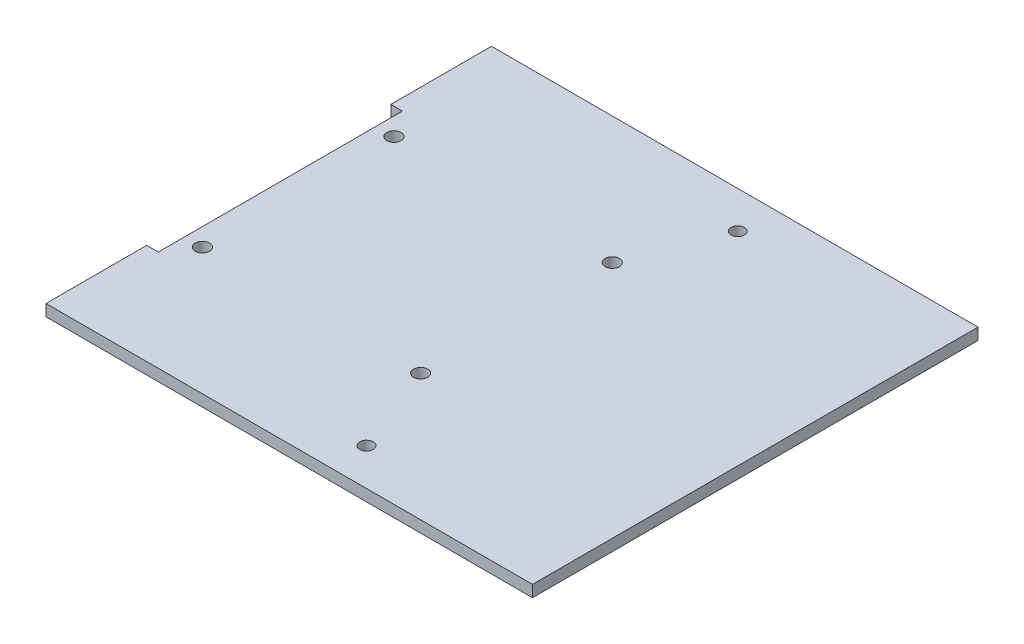
from build123d import *

# Parameters (mm, degrees)
EXTRUDE_1_DEPTH                  = 2.6
SKETCH_2_W                       = 100
SKETCH_2_H                       = 24
EXTRUDE_2_DEPTH                  = 2.6
SKETCH_4_W                       = 100
SKETCH_4_H                       = 24
EXTRUDE_3_DEPTH                  = 2.6
SKETCH_5_W                       = 62
SKETCH_5_H                       = 100
EXTRUDE_5_DEPTH                  = 2.6
SKETCH_7_W                       = 62
SKETCH_7_H                       = 100
EXTRUDE_6_DEPTH                  = 2.6
SKETCH_8_W                       = 59.4
SKETCH_8_H                       = 60
CUT_EXTRUDE_1_DEPTH              = 2.6
SKETCH_9_W                       = 59.4
SKETCH_9_H                       = 60
CUT_EXTRUDE_2_DEPTH              = 2.6
SKETCH_11_W                      = 59.4
SKETCH_11_H                      = 26.6
EXTRUDE_7_DEPTH                  = 2.6
SKETCH_12_W                      = 59.4
SKETCH_12_H                      = 26.6
EXTRUDE_8_DEPTH                  = 2.6
SKETCH_14_W                      = 59.4
SKETCH_14_H                      = 26.6
EXTRUDE_9_DEPTH                  = 2.6
SKETCH_15_W                      = 59.4
SKETCH_15_H                      = 26.6
EXTRUDE_10_DEPTH                 = 2.6
SKETCH_16_R                      = 1.6
CUT_EXTRUDE_3_DEPTH              = 127.775391934
SKETCH_17_W                      = 80
SKETCH_17_H                      = 64
CUT_EXTRUDE_4_DEPTH              = 127.775391934
SKETCH_21_W                      = 59.4
SKETCH_21_H                      = 54.8
EXTRUDE_11_DEPTH                 = 2.6
SKETCH_22_R                      = 1.6
CUT_EXTRUDE_5_DEPTH              = 2.6
SKETCH_23_W                      = 59.4
SKETCH_23_H                      = 54.8
EXTRUDE_13_DEPTH                 = 2.6
CUT_EXTRUDE_8_DEPTH              = 2.6
SKETCH_25_W                      = 54.8
SKETCH_25_H                      = 21.4
CUT_EXTRUDE_9_DEPTH              = 2.6
CUT_EXTRUDE_11_REACH             = 143.787
SKETCH_28_R                      = 1.5
CUT_EXTRUDE_11_DIRECTION_2_DEPTH = 142.787023384
SKETCH_31_W                      = 41.995824489
SKETCH_31_H                      = 54.8
CUT_EXTRUDE_14_DEPTH             = 2.6
SKETCH_32_W                      = 59.4
SKETCH_32_H                      = 24
CUT_EXTRUDE_15_DEPTH             = 70.6
SKETCH_33_W                      = 104
SKETCH_33_H                      = 100
CUT_EXTRUDE_16_DEPTH             = 2.6
SKETCH_34_W                      = 104
SKETCH_34_H                      = 99.672593916
EXTRUDE_14_DEPTH                 = 2.6
SKETCH_35_R                      = 1.6
CUT_EXTRUDE_24_DEPTH             = 2.6
SKETCH_36_W                      = 59.4
SKETCH_36_H                      = 100
CUT_EXTRUDE_25_DEPTH             = 2.6
SKETCH_37_W                      = 36
SKETCH_37_H                      = 2.6
EXTRUDE_17_DEPTH                 = 36
SKETCH_41_W                      = 36
SKETCH_41_H                      = 12
CUT_EXTRUDE_27_DEPTH             = 2.6
SKETCH_42_R                      = 1.6
CUT_EXTRUDE_28_DEPTH             = 2.6
SKETCH_43_R                      = 2
CUT_EXTRUDE_29_DEPTH             = 2.6
SKETCH_44_W                      = 104
SKETCH_44_H                      = 99.672593916
EXTRUDE_18_DEPTH                 = 2.6
SKETCH_45_R                      = 1.6
CUT_EXTRUDE_30_DEPTH             = 2.6
SKETCH_46_W                      = 80
SKETCH_46_H                      = 64
CUT_EXTRUDE_31_DEPTH             = 2.6
SKETCH_47_W                      = 40
SKETCH_47_H                      = 30
CUT_EXTRUDE_32_DEPTH             = 2.6
SKETCH_48_W                      = 12
SKETCH_48_H                      = 64
CUT_EXTRUDE_33_DEPTH             = 2.6
SKETCH_49_W                      = 40
SKETCH_49_H                      = 20
CUT_EXTRUDE_34_DEPTH             = 2.6
SKETCH_50_W                      = 39.937786469
SKETCH_50_H                      = 20
CUT_EXTRUDE_35_DEPTH             = 2.6
SKETCH_51_R                      = 9
CUT_EXTRUDE_36_DEPTH             = 2.6
CUT_EXTRUDE_38_REACH             = 143.787
SKETCH_52_W                      = 15
SKETCH_52_H                      = 15
SKETCH_55_W                      = 36
SKETCH_55_H                      = 2.6
CUT_EXTRUDE_39_DEPTH             = 12
CUT_EXTRUDE_START                = -109.2
SKETCH_56_W                      = 10
SKETCH_56_H                      = 10
CUT_EXTRUDE_40_DEPTH             = 109.2
CUT_EXTRUDE_41_REACH             = 129.293
SKETCH_57_R                      = 1.5
SKETCH_58_W                      = 104
SKETCH_58_H                      = 2.6
EXTRUDE_19_DEPTH                 = 0.327406084
SKETCH_59_W                      = 59.4
SKETCH_59_H                      = 24
CUT_EXTRUDE_42_DEPTH             = 60
SKETCH_60_W                      = 168.6
SKETCH_60_H                      = 100
CUT_EXTRUDE_43_DEPTH             = 2.6
CUT_EXTRUDE_44_DEPTH             = 200
CUT_EXTRUDE_44_DEPTH_BACK        = 200
SKETCH_61_W                      = 100
SKETCH_61_H                      = 21.4
SKETCH_62_W                      = 20
SKETCH_62_H                      = 2.6
EXTRUDE_20_DEPTH                 = 39.937786469
SKETCH_63_W                      = 40
SKETCH_63_H                      = 2.6
EXTRUDE_21_DEPTH                 = 50
SKETCH_64_R                      = 1.6
CUT_EXTRUDE_45_DEPTH             = 2.6
SKETCH_65_R                      = 1.6
EXTRUDE_23_DEPTH                 = 2.6


with BuildPart() as part:
    # 草图1 → 凸台-拉伸1 (new body)
    with BuildSketch(Plane(origin=(0, 0, 0), x_dir=(1, 0, 0), z_dir=(0, 1, 0))):
        Polygon((52, 50), (0, 50), (-52, 50), (-52, -50), (52, -50), align=None)
    extrude(amount=EXTRUDE_1_DEPTH)

    # 草图2 → 凸台-拉伸2 (add)
    with BuildSketch(Plane.ZY.offset(52)):
        with Locations((0, 12)):
            Rectangle(SKETCH_2_W, SKETCH_2_H)
    extrude(amount=EXTRUDE_2_DEPTH)

    # 草图4 → 凸台-拉伸3 (add)
    with BuildSketch(Plane(origin=(52, 0, 0), x_dir=(0, 0, -1), z_dir=(1, 0, 0))):
        with Locations((0, 12)):
            Rectangle(SKETCH_4_W, SKETCH_4_H)
    extrude(amount=EXTRUDE_3_DEPTH)

    # 草图5 → 凸台-拉伸5 (add)
    with BuildSketch(Plane(origin=(0, 24, 0), x_dir=(1, 0, 0), z_dir=(0, 1, 0))):
        with Locations((-83, 0)):
            Rectangle(SKETCH_5_W, SKETCH_5_H)
    extrude(amount=EXTRUDE_5_DEPTH)

    # 草图7 → 凸台-拉伸6 (add)
    with BuildSketch(Plane(origin=(0, 24, 0), x_dir=(1, 0, 0), z_dir=(0, 1, 0))):
        with Locations((83, 0)):
            Rectangle(SKETCH_7_W, SKETCH_7_H)
    extrude(amount=EXTRUDE_6_DEPTH)

    # 草图8 → 切除-拉伸1 (cut)
    with BuildSketch(Plane(origin=(0, 24, 0), x_dir=(1, 0, 0), z_dir=(0, 1, 0))):
        with Locations((-84.3, 0)):
            Rectangle(SKETCH_8_W, SKETCH_8_H)
    extrude(amount=CUT_EXTRUDE_1_DEPTH, mode=Mode.SUBTRACT)

    # 草图9 → 切除-拉伸2 (cut)
    with BuildSketch(Plane.XZ.offset(-24)):
        with Locations((84.3, 0)):
            Rectangle(SKETCH_9_W, SKETCH_9_H)
    extrude(amount=-CUT_EXTRUDE_2_DEPTH, mode=Mode.SUBTRACT)

    # 草图11 → 凸台-拉伸7 (add)
    with BuildSketch(Plane(origin=(0, 0, 30), x_dir=(-1, 0, 0), z_dir=(0, 0, -1))):
        with Locations((-84.3, 13.3)):
            Rectangle(SKETCH_11_W, SKETCH_11_H)
    extrude(amount=EXTRUDE_7_DEPTH)

    # 草图12 → 凸台-拉伸8 (add)
    with BuildSketch(Plane.XY.offset(-30)):
        with Locations((84.3, 13.3)):
            Rectangle(SKETCH_12_W, SKETCH_12_H)
    extrude(amount=EXTRUDE_8_DEPTH)

    # 草图14 → 凸台-拉伸9 (add)
    with BuildSketch(Plane.XY.offset(-30)):
        with Locations((-84.3, 13.3)):
            Rectangle(SKETCH_14_W, SKETCH_14_H)
    extrude(amount=EXTRUDE_9_DEPTH)

    # 草图15 → 凸台-拉伸10 (add)
    with BuildSketch(Plane(origin=(0, 0, 30), x_dir=(-1, 0, 0), z_dir=(0, 0, -1))):
        with Locations((84.3, 13.3)):
            Rectangle(SKETCH_15_W, SKETCH_15_H)
    extrude(amount=EXTRUDE_10_DEPTH)

    # 草图16 → 切除-拉伸3 (cut, through all)
    with BuildSketch(Plane(origin=(0, 2.6, 0), x_dir=(1, 0, 0), z_dir=(0, 1, 0))):
        with Locations(Location((-47.5, 37.465, 0), (0, 0, 270))):
            Circle(SKETCH_16_R)
        with Locations(Location((47.5, 37.465, 0), (0, 0, 90))):
            Circle(SKETCH_16_R)
        with Locations(Location((-47.5, -37.465, 0), (0, 0, 90))):
            Circle(SKETCH_16_R)
        with Locations(Location((47.5, -37.465, 0), (0, 0, 270))):
            Circle(SKETCH_16_R)
    extrude(amount=-CUT_EXTRUDE_3_DEPTH, mode=Mode.SUBTRACT)

    # 草图17 → 切除-拉伸4 (cut, through all)
    with BuildSketch(Plane(origin=(0, 2.6, 0), x_dir=(1, 0, 0), z_dir=(0, 1, 0))):
        Rectangle(SKETCH_17_W, SKETCH_17_H)
    extrude(amount=-CUT_EXTRUDE_4_DEPTH, mode=Mode.SUBTRACT)

    # 草图21 → 凸台-拉伸11 (add)
    with BuildSketch(Plane.XZ):
        with Locations((-84.3, 0)):
            Rectangle(SKETCH_21_W, SKETCH_21_H)
    extrude(amount=-EXTRUDE_11_DEPTH)

    # 草图22 → 切除-拉伸5 (cut)
    with BuildSketch(Plane(origin=(0, 2.6, 0), x_dir=(1, 0, 0), z_dir=(0, 1, 0))):
        with Locations(Location((-109, 18, 0), (0, 0, 270))):
            Circle(SKETCH_22_R)
        with Locations(Location((-109, 0, 0), (0, 0, 270))):
            Circle(SKETCH_22_R)
        with Locations(Location((-109, -18, 0), (0, 0, 90))):
            Circle(SKETCH_22_R)
    extrude(amount=-CUT_EXTRUDE_5_DEPTH, mode=Mode.SUBTRACT)

    # 草图23 → 凸台-拉伸13 (add)
    with BuildSketch(Plane(origin=(0, 26.6, 0), x_dir=(1, 0, 0), z_dir=(0, 1, 0))):
        with Locations((-84.3, 0)):
            Rectangle(SKETCH_23_W, SKETCH_23_H)
    extrude(amount=-EXTRUDE_13_DEPTH)

    # 草图24 → 切除-拉伸8 (cut)
    with BuildSketch(Plane(origin=(0, 26.6, 0), x_dir=(1, 0, 0), z_dir=(0, 1, 0))):
        Polygon((-114, 27.4), (-104, 27.4), (-104, 0.9702404), (-94.7, 0.9702404), (-94.7, 6.15), (-72, 6.15), (-72, 0.9702404), (-62.7, 0.9702404), (-62.7, -1.0297596), (-72, -1.0297596), (-72, -6.15), (-94.7, -6.15), (-94.7, -1.0297596), (-104, -1.0297596), (-104, -27.4), (-114, -27.4), align=None)
    extrude(amount=-CUT_EXTRUDE_8_DEPTH, mode=Mode.SUBTRACT)

    # 草图25 → 切除-拉伸9 (cut)
    with BuildSketch(Plane.ZY.offset(54.6)):
        with Locations((0, 13.3)):
            Rectangle(SKETCH_25_W, SKETCH_25_H)
    extrude(amount=-CUT_EXTRUDE_9_DEPTH, mode=Mode.SUBTRACT)

    # 切除-拉伸11: up to this face of the body (flat: up to its plane)
    cut_extrude_11_end = Plane(part.part.faces().sort_by_distance((-84.3, 12, -30))[0])
    # 草图28 → 切除-拉伸11 (cut, up to the picked face)
    with BuildSketch(Plane.XY.offset(30), mode=Mode.PRIVATE) as cut_extrude_11_sk1:
        with Locations(Location((-87.2, 20.75, 0), (0, 0, 180))):
            Circle(SKETCH_28_R)
    cut_extrude_11_tool1 = split(extrude(cut_extrude_11_sk1.sketch, amount=-CUT_EXTRUDE_11_REACH, mode=Mode.PRIVATE), bisect_by=cut_extrude_11_end, keep=Keep.BOTH, mode=Mode.PRIVATE)
    # 草图28 → 切除-拉伸11 (cut, up to the picked face)
    with BuildSketch(Plane.XY.offset(30), mode=Mode.PRIVATE) as cut_extrude_11_sk2:
        with Locations(Location((-87.2, 3.25, 0), (0, 0, 180))):
            Circle(SKETCH_28_R)
    cut_extrude_11_tool2 = split(extrude(cut_extrude_11_sk2.sketch, amount=-CUT_EXTRUDE_11_REACH, mode=Mode.PRIVATE), bisect_by=cut_extrude_11_end, keep=Keep.BOTH, mode=Mode.PRIVATE)
    add(cut_extrude_11_tool1.solids().sort_by(Axis((-87.2, 20.75, 30), (0, 0, -1)))[0], mode=Mode.SUBTRACT)
    add(cut_extrude_11_tool2.solids().sort_by(Axis((-87.2, 3.25, 30), (0, 0, -1)))[0], mode=Mode.SUBTRACT)

    # 草图28 → 切除-拉伸11 direction 2 (cut)
    with BuildSketch(Plane.XY.offset(30)):
        with Locations(Location((-87.2, 20.75, 0), (0, 0, 180))):
            Circle(SKETCH_28_R)
        with Locations(Location((-87.2, 3.25, 0), (0, 0, 180))):
            Circle(SKETCH_28_R)
    extrude(amount=CUT_EXTRUDE_11_DIRECTION_2_DEPTH, mode=Mode.SUBTRACT)

    # 草图31 → 切除-拉伸14 (cut)
    with BuildSketch(Plane(origin=(0, 2.6, 0), x_dir=(1, 0, 0), z_dir=(0, 1, 0))):
        with Locations((-72.997912245, 0)):
            Rectangle(SKETCH_31_W, SKETCH_31_H)
    extrude(amount=-CUT_EXTRUDE_14_DEPTH, mode=Mode.SUBTRACT)

    # 草图32 → 切除-拉伸15 (cut)
    with BuildSketch(Plane.XY.offset(30)):
        with Locations((84.3, 12)):
            Rectangle(SKETCH_32_W, SKETCH_32_H)
    extrude(amount=-CUT_EXTRUDE_15_DEPTH, mode=Mode.SUBTRACT)

    # 草图33 → 切除-拉伸16 (cut)
    with BuildSketch(Plane(origin=(0, 2.6, 0), x_dir=(1, 0, 0), z_dir=(0, 1, 0))):
        Rectangle(SKETCH_33_W, SKETCH_33_H)
    extrude(amount=-CUT_EXTRUDE_16_DEPTH, mode=Mode.SUBTRACT)


with BuildPart() as cut_extrude_16_piece_1:
    # of the separate pieces the step leaves, piece 1, a body of its own (cut_extrude_16_pieces)
    add(part.part.solids().sort_by_distance((-52, 0, -50))[0])



with BuildPart() as cut_extrude_16_piece_2:
    # of the separate pieces the step leaves, piece 2, a body of its own (cut_extrude_16_pieces)
    add(part.part.solids().sort_by_distance((114, 26.6, -50))[0])


with BuildPart() as cut_extrude_16_piece_1_1:
    add(cut_extrude_16_piece_1.part)

    add(cut_extrude_16_piece_2.part)  # 凸台-拉伸14 merges 切除-拉伸16 piece 2
    # 草图34 → 凸台-拉伸14 (add)
    with BuildSketch(Plane.XZ):
        with Locations((0, 0.163703042)):
            Rectangle(SKETCH_34_W, SKETCH_34_H)
    extrude(amount=-EXTRUDE_14_DEPTH)

    # 草图35 → 切除-拉伸24 (cut)
    with BuildSketch(Plane(origin=(0, 2.6, 0), x_dir=(1, 0, 0), z_dir=(0, 1, 0))):
        with Locations(Location((-39.5, 21.5, 0), (0, 0, 270))):
            Circle(SKETCH_35_R)
        with Locations(Location((9.5, 21.5, 0), (0, 0, 270))):
            Circle(SKETCH_35_R)
        with Locations(Location((9.5, -21.5, 0), (0, 0, 90))):
            Circle(SKETCH_35_R)
        with Locations(Location((-39.5, -21.5, 0), (0, 0, 90))):
            Circle(SKETCH_35_R)
    extrude(amount=-CUT_EXTRUDE_24_DEPTH, mode=Mode.SUBTRACT)

    # 草图36 → 切除-拉伸25 (cut)
    with BuildSketch(Plane(origin=(0, 26.6, 0), x_dir=(1, 0, 0), z_dir=(0, 1, 0))):
        with Locations((84.3, 0)):
            Rectangle(SKETCH_36_W, SKETCH_36_H)
    extrude(amount=-CUT_EXTRUDE_25_DEPTH, mode=Mode.SUBTRACT)

    # 草图37 → 凸台-拉伸17 (add)
    with BuildSketch(Plane(origin=(54.6, 0, 0), x_dir=(0, 0, -1), z_dir=(1, 0, 0))):
        with Locations((0, 13.3)):
            Rectangle(SKETCH_37_W, SKETCH_37_H)
    extrude(amount=EXTRUDE_17_DEPTH)

    # 草图41 → 切除-拉伸27 (cut)
    with BuildSketch(Plane(origin=(54.6, 0, 0), x_dir=(0, 0, -1), z_dir=(1, 0, 0))):
        with Locations((0, 20.6)):
            Rectangle(SKETCH_41_W, SKETCH_41_H)
    extrude(amount=-CUT_EXTRUDE_27_DEPTH, mode=Mode.SUBTRACT)

    # 草图42 → 切除-拉伸28 (cut)
    with BuildSketch(Plane(origin=(0, 14.6, 0), x_dir=(1, 0, 0), z_dir=(0, 1, 0))):
        with Locations(Location((88.1, 15.5, 0), (0, 0, 270))):
            Circle(SKETCH_42_R)
        with Locations(Location((88.1, -15.5, 0), (0, 0, 90))):
            Circle(SKETCH_42_R)
        with Locations(Location((57.1, 15.5, 0), (0, 0, 270))):
            Circle(SKETCH_42_R)
        with Locations(Location((57.1, -15.5, 0), (0, 0, 90))):
            Circle(SKETCH_42_R)
    extrude(amount=-CUT_EXTRUDE_28_DEPTH, mode=Mode.SUBTRACT)

    # 草图43 → 切除-拉伸29 (cut)
    with BuildSketch(Plane(origin=(0, 14.6, 0), x_dir=(1, 0, 0), z_dir=(0, 1, 0))):
        with Locations(Location((61.1, 14.5, 0), (0, 0, 270))):
            Circle(SKETCH_43_R)
        with Locations(Location((84.1, 14.5, 0), (0, 0, 270))):
            Circle(SKETCH_43_R)
        with Locations(Location((84.1, -14.5, 0), (0, 0, 90))):
            Circle(SKETCH_43_R)
        with Locations(Location((61.1, -14.5, 0), (0, 0, 90))):
            Circle(SKETCH_43_R)
    extrude(amount=-CUT_EXTRUDE_29_DEPTH, mode=Mode.SUBTRACT)

    # 草图44 → 凸台-拉伸18 (add)
    with BuildSketch(Plane(origin=(0, 26.6, 0), x_dir=(1, 0, 0), z_dir=(0, 1, 0))):
        with Locations((0, -0.163703042)):
            Rectangle(SKETCH_44_W, SKETCH_44_H)
    extrude(amount=-EXTRUDE_18_DEPTH)

    # 草图45 → 切除-拉伸30 (cut)
    with BuildSketch(Plane(origin=(0, 26.6, 0), x_dir=(1, 0, 0), z_dir=(0, 1, 0))):
        with Locations(Location((-47.5, -37.465, 0), (0, 0, 270))):
            Circle(SKETCH_45_R)
        with Locations(Location((-47.5, 37.465, 0), (0, 0, 90))):
            Circle(SKETCH_45_R)
        with Locations(Location((47.5, -37.465, 0), (0, 0, 90))):
            Circle(SKETCH_45_R)
        with Locations(Location((47.5, 37.465, 0), (0, 0, 270))):
            Circle(SKETCH_45_R)
    extrude(amount=-CUT_EXTRUDE_30_DEPTH, mode=Mode.SUBTRACT)

    # 草图46 → 切除-拉伸31 (cut)
    with BuildSketch(Plane(origin=(0, 26.6, 0), x_dir=(1, 0, 0), z_dir=(0, 1, 0))):
        Rectangle(SKETCH_46_W, SKETCH_46_H)
    extrude(amount=-CUT_EXTRUDE_31_DEPTH, mode=Mode.SUBTRACT)

    # 草图47 → 切除-拉伸32 (cut)
    with BuildSketch(Plane(origin=(0, 2.6, 0), x_dir=(1, 0, 0), z_dir=(0, 1, 0))):
        with Locations((-15, 0)):
            Rectangle(SKETCH_47_W, SKETCH_47_H)
    extrude(amount=-CUT_EXTRUDE_32_DEPTH, mode=Mode.SUBTRACT)

    # 草图48 → 切除-拉伸33 (cut)
    with BuildSketch(Plane(origin=(0, 26.6, 0), x_dir=(1, 0, 0), z_dir=(0, 1, 0))):
        with Locations((-46, 0)):
            Rectangle(SKETCH_48_W, SKETCH_48_H)
    extrude(amount=-CUT_EXTRUDE_33_DEPTH, mode=Mode.SUBTRACT)

    # 草图49 → 切除-拉伸34 (cut)
    with BuildSketch(Plane(origin=(0, 2.6, 0), x_dir=(1, 0, 0), z_dir=(0, 1, 0))):
        with Locations((-15, -25)):
            Rectangle(SKETCH_49_W, SKETCH_49_H)
    extrude(amount=-CUT_EXTRUDE_34_DEPTH, mode=Mode.SUBTRACT)

    # 草图50 → 切除-拉伸35 (cut)
    with BuildSketch(Plane(origin=(0, 2.6, 0), x_dir=(1, 0, 0), z_dir=(0, 1, 0))):
        with Locations((-15.031106765, 25)):
            Rectangle(SKETCH_50_W, SKETCH_50_H)
    extrude(amount=-CUT_EXTRUDE_35_DEPTH, mode=Mode.SUBTRACT)

    # 草图51 → 切除-拉伸36 (cut)
    with BuildSketch(Plane(origin=(0, 14.6, 0), x_dir=(1, 0, 0), z_dir=(0, 1, 0))):
        with Locations(Location((71.3, 0, 0), (0, 0, 270))):
            Circle(SKETCH_51_R)
    extrude(amount=-CUT_EXTRUDE_36_DEPTH, mode=Mode.SUBTRACT)

    # 切除-拉伸38: up to this face of the body (flat: up to its plane)
    cut_extrude_38_end = Plane(cut_extrude_16_piece_1_1.part.faces().sort_by_distance((-84.270953692, 12, -30))[0])
    # 草图52 → 切除-拉伸38 (cut, up to the picked face)
    with BuildSketch(Plane.XY.offset(30), mode=Mode.PRIVATE) as cut_extrude_38_sk1:
        with Locations((-74.7, 12)):
            Rectangle(SKETCH_52_W, SKETCH_52_H)
    cut_extrude_38_tool1 = split(extrude(cut_extrude_38_sk1.sketch, amount=-CUT_EXTRUDE_38_REACH, mode=Mode.PRIVATE), bisect_by=cut_extrude_38_end, keep=Keep.BOTH, mode=Mode.PRIVATE)
    # 草图52 → 切除-拉伸38 (cut, up to the picked face)
    with BuildSketch(Plane.XY.offset(30), mode=Mode.PRIVATE) as cut_extrude_38_sk2:
        with Locations((-99.7, 12)):
            Rectangle(SKETCH_52_W, SKETCH_52_H)
    cut_extrude_38_tool2 = split(extrude(cut_extrude_38_sk2.sketch, amount=-CUT_EXTRUDE_38_REACH, mode=Mode.PRIVATE), bisect_by=cut_extrude_38_end, keep=Keep.BOTH, mode=Mode.PRIVATE)
    add(cut_extrude_38_tool1.solids().sort_by(Axis((-74.7, 12, 30), (0, 0, -1)))[0], mode=Mode.SUBTRACT)
    add(cut_extrude_38_tool2.solids().sort_by(Axis((-99.7, 12, 30), (0, 0, -1)))[0], mode=Mode.SUBTRACT)

    # 草图55 → 切除-拉伸39 (cut)
    with BuildSketch(Plane(origin=(52, 0, 0), x_dir=(0, 0, -1), z_dir=(1, 0, 0))):
        with Locations((0, 25.3)):
            Rectangle(SKETCH_55_W, SKETCH_55_H)
    extrude(amount=-CUT_EXTRUDE_39_DEPTH, mode=Mode.SUBTRACT)

    # 草图56 → 切除-拉伸40 (cut)
    with BuildSketch(Plane(origin=(54.6, 0, 0), x_dir=(0, 0, -1), z_dir=(1, 0, 0)).offset(CUT_EXTRUDE_START)):
        with Locations((-37, 13.3)):
            Rectangle(SKETCH_56_W, SKETCH_56_H)
        with Locations((37, 13.3)):
            Rectangle(SKETCH_56_W, SKETCH_56_H)
    extrude(amount=CUT_EXTRUDE_40_DEPTH, mode=Mode.SUBTRACT)

    # 切除-拉伸41: up to this face of the body (flat: up to its plane)
    cut_extrude_41_end = Plane(cut_extrude_16_piece_1_1.part.faces().sort_by_distance((52.639745935, 26.6, -34))[0])
    # 草图57 → 切除-拉伸41 (cut, up to the picked face)
    with BuildSketch(Plane.XZ, mode=Mode.PRIVATE) as cut_extrude_41_sk1:
        with Locations(Location((9, -41.672593916, 0), (0, 0, 270))):
            Circle(SKETCH_57_R)
    cut_extrude_41_tool1 = split(extrude(cut_extrude_41_sk1.sketch, amount=-CUT_EXTRUDE_41_REACH, mode=Mode.PRIVATE), bisect_by=cut_extrude_41_end, keep=Keep.BOTH, mode=Mode.PRIVATE)
    # 草图57 → 切除-拉伸41 (cut, up to the picked face)
    with BuildSketch(Plane.XZ, mode=Mode.PRIVATE) as cut_extrude_41_sk2:
        with Locations(Location((9, 41.672593916, 0), (0, 0, 270))):
            Circle(SKETCH_57_R)
    cut_extrude_41_tool2 = split(extrude(cut_extrude_41_sk2.sketch, amount=-CUT_EXTRUDE_41_REACH, mode=Mode.PRIVATE), bisect_by=cut_extrude_41_end, keep=Keep.BOTH, mode=Mode.PRIVATE)
    add(cut_extrude_41_tool1.solids().sort_by(Axis((9, 0, -41.672594), (0, 1, 0)))[0], mode=Mode.SUBTRACT)
    add(cut_extrude_41_tool2.solids().sort_by(Axis((9, 0, 41.672594), (0, 1, 0)))[0], mode=Mode.SUBTRACT)

    # 草图58 → 凸台-拉伸19 (add)
    with BuildSketch(Plane(origin=(0, 0, -49.672593916), x_dir=(-1, 0, 0), z_dir=(0, 0, -1))):
        with Locations((0, 25.3)):
            Rectangle(SKETCH_58_W, SKETCH_58_H)
        with Locations((0, 1.3)):
            Rectangle(SKETCH_58_W, SKETCH_58_H)
    extrude(amount=EXTRUDE_19_DEPTH)

    # 草图59 → 切除-拉伸42 (cut)
    with BuildSketch(Plane(origin=(0, 0, -30), x_dir=(-1, 0, 0), z_dir=(0, 0, -1))):
        with Locations((84.3, 12)):
            Rectangle(SKETCH_59_W, SKETCH_59_H)
    extrude(amount=-CUT_EXTRUDE_42_DEPTH, mode=Mode.SUBTRACT)

    # 草图60 → 切除-拉伸43 (cut)
    with BuildSketch(Plane(origin=(0, 26.6, 0), x_dir=(1, 0, 0), z_dir=(0, 1, 0))):
        with Locations((-29.7, 0)):
            Rectangle(SKETCH_60_W, SKETCH_60_H)
    extrude(amount=-CUT_EXTRUDE_43_DEPTH, mode=Mode.SUBTRACT)

    # 草图61 → 切除-拉伸44 (cut, two sides: drawn at the far end of the back side and taken through both)
    with BuildSketch(Plane(origin=(-52, 0, 0), x_dir=(0, 0, -1), z_dir=(1, 0, 0)).offset(-CUT_EXTRUDE_44_DEPTH_BACK)):
        with Locations((0, 13.3)):
            Rectangle(SKETCH_61_W, SKETCH_61_H)
    extrude(amount=CUT_EXTRUDE_44_DEPTH + CUT_EXTRUDE_44_DEPTH_BACK, mode=Mode.SUBTRACT)

    # 草图62 → 凸台-拉伸20 (add)
    with BuildSketch(Plane.ZY.offset(-4.937786469)):
        with Locations((-25, 1.3)):
            Rectangle(SKETCH_62_W, SKETCH_62_H)
    extrude(amount=EXTRUDE_20_DEPTH)

    # 草图63 → 凸台-拉伸21 (add)
    with BuildSketch(Plane.XY.offset(-15)):
        with Locations((-15, 1.3)):
            Rectangle(SKETCH_63_W, SKETCH_63_H)
    extrude(amount=EXTRUDE_21_DEPTH)

    # 草图64 → 切除-拉伸45 (cut)
    with BuildSketch(Plane.XZ):
        with Locations(Location((-48, 21.5, 0), (0, 0, 270))):
            Circle(SKETCH_64_R)
        with Locations(Location((-48, -21.5, 0), (0, 0, 270))):
            Circle(SKETCH_64_R)
        with Locations(Location((1, 21.5, 0), (0, 0, 270))):
            Circle(SKETCH_64_R)
        with Locations(Location((1, -21.5, 0), (0, 0, 270))):
            Circle(SKETCH_64_R)
    extrude(amount=-CUT_EXTRUDE_45_DEPTH, mode=Mode.SUBTRACT)

    # 草图65 → 凸台-拉伸23 (add)
    with BuildSketch(Plane.XZ):
        with Locations((-39.5, 21.5)):
            Circle(SKETCH_65_R)
        with Locations((-39.5, -21.5)):
            Circle(SKETCH_65_R)
        with Locations((9.5, -21.5)):
            Circle(SKETCH_65_R)
        with Locations((9.5, 21.5)):
            Circle(SKETCH_65_R)
    extrude(amount=-EXTRUDE_23_DEPTH)


solid = cut_extrude_16_piece_1_1.part
